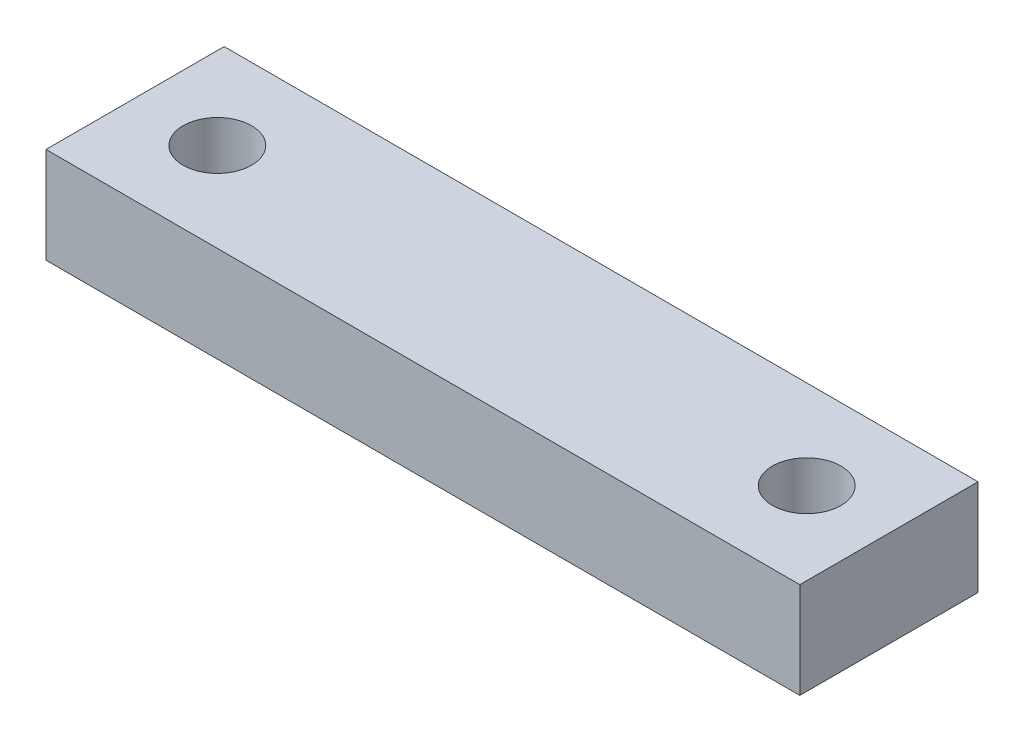
from build123d import *

# Parameters (mm, degrees)
SKETCH1_W           = 55
SKETCH1_H           = 13
BOSS_EXTRUDE1_DEPTH = 7
SKETCH2_R           = 2.5
CUT_EXTRUDE1_DEPTH  = 7


with BuildPart() as part:
    # Sketch1 → Boss-Extrude1 (new body)
    with BuildSketch(Plane(origin=(0, 0, 0), x_dir=(1, 0, 0), z_dir=(0, 1, 0))):
        Rectangle(SKETCH1_W, SKETCH1_H)
    extrude(amount=BOSS_EXTRUDE1_DEPTH)

    # Sketch2 → Cut-Extrude1 (cut)
    with BuildSketch(Plane(origin=(0, 7, 0), x_dir=(1, 0, 0), z_dir=(0, 1, 0))):
        with Locations(Location((-21.5, 0, 0), (0, 0, 270))):
            Circle(SKETCH2_R)
        with Locations(Location((21.5, 0, 0), (0, 0, 270))):
            Circle(SKETCH2_R)
    extrude(amount=-CUT_EXTRUDE1_DEPTH, mode=Mode.SUBTRACT)


solid = part.part
